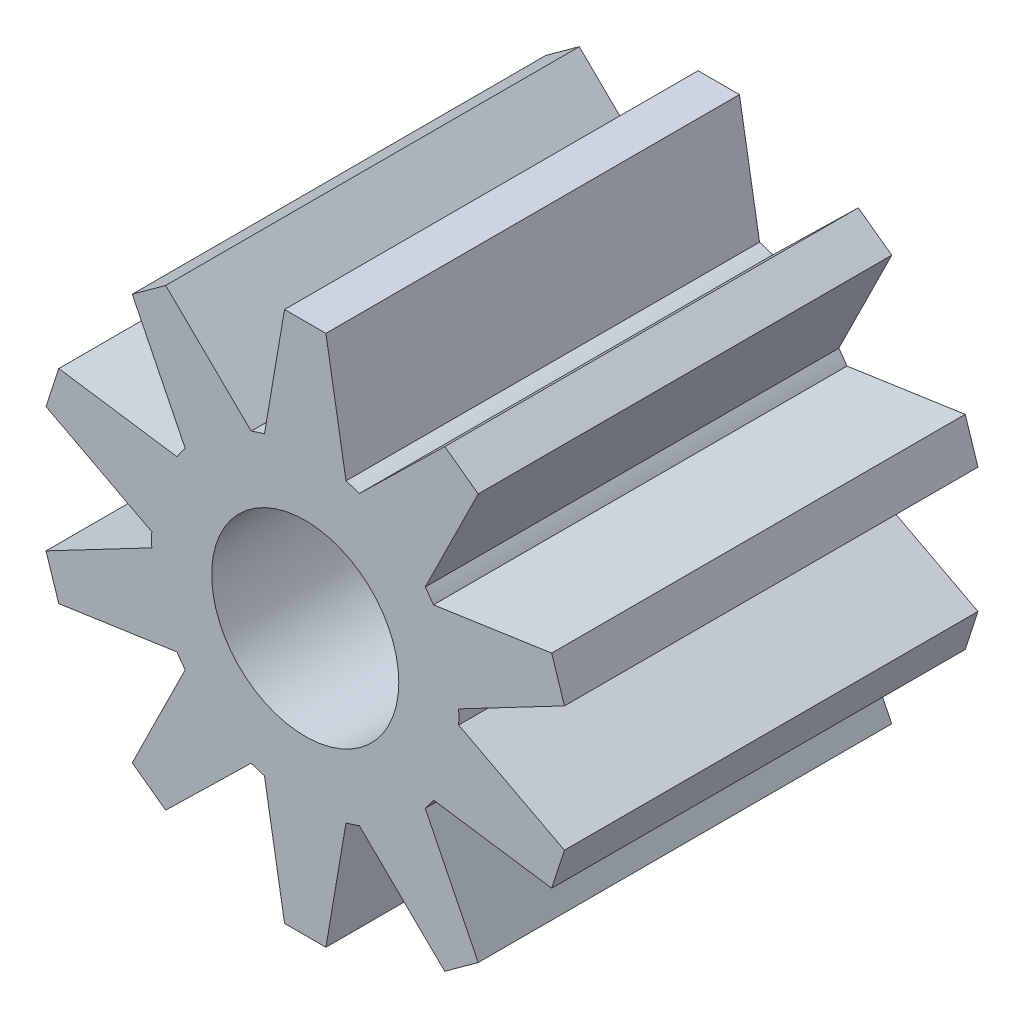
from build123d import *

# Parameters (mm, degrees)
SKETCH1_R           = 1.651
BOSS_EXTRUDE1_DEPTH = 4.445
SKETCH2_R           = 1.00584
CUT_EXTRUDE1_DEPTH  = 6.973853634


with BuildPart() as part:
    # Sketch1 → Boss-Extrude1 (new body)
    with BuildSketch(Plane.XY):
        Circle(SKETCH1_R)
        Polygon((-0.22225, 2.8575), (0.22225, 2.8575), (0.43815, 1.591799478), (-0.43815, 1.591799478), align=None)
        Polygon((1.859400385, 2.181130789), (1.290107054, 1.030254721), (0.581165462, 1.545330937), (1.499792331, 2.442401334), align=None)
        Polygon((2.786323022, 0.671643751), (1.649287062, 0.075187678), (1.37849547, 0.908598503), (2.648964968, 1.094388372), align=None)
        Polygon((2.648964968, -1.094388372), (1.37849547, -0.908598503), (1.649287062, -0.075187678), (2.786323022, -0.671643751), align=None)
        Polygon((1.499792331, -2.442401334), (0.581165462, -1.545330937), (1.290107054, -1.030254721), (1.859400385, -2.181130789), align=None)
        Polygon((-0.22225, -2.8575), (-0.43815, -1.591799478), (0.43815, -1.591799478), (0.22225, -2.8575), align=None)
        Polygon((-1.859400385, -2.181130789), (-1.290107054, -1.030254721), (-0.581165462, -1.545330937), (-1.499792331, -2.442401334), align=None)
        Polygon((-2.786323022, -0.671643751), (-1.649287062, -0.075187678), (-1.37849547, -0.908598503), (-2.648964968, -1.094388372), align=None)
        Polygon((-2.648964968, 1.094388372), (-1.37849547, 0.908598503), (-1.649287062, 0.075187678), (-2.786323022, 0.671643751), align=None)
        Polygon((-1.499792331, 2.442401334), (-0.581165462, 1.545330937), (-1.290107054, 1.030254721), (-1.859400385, 2.181130789), align=None)
    extrude(amount=BOSS_EXTRUDE1_DEPTH)

    # Sketch2 → Cut-Extrude1 (cut, through all)
    with BuildSketch(Plane.XY.offset(4.445)):
        Circle(SKETCH2_R)
    extrude(amount=-CUT_EXTRUDE1_DEPTH, mode=Mode.SUBTRACT)


solid = part.part
